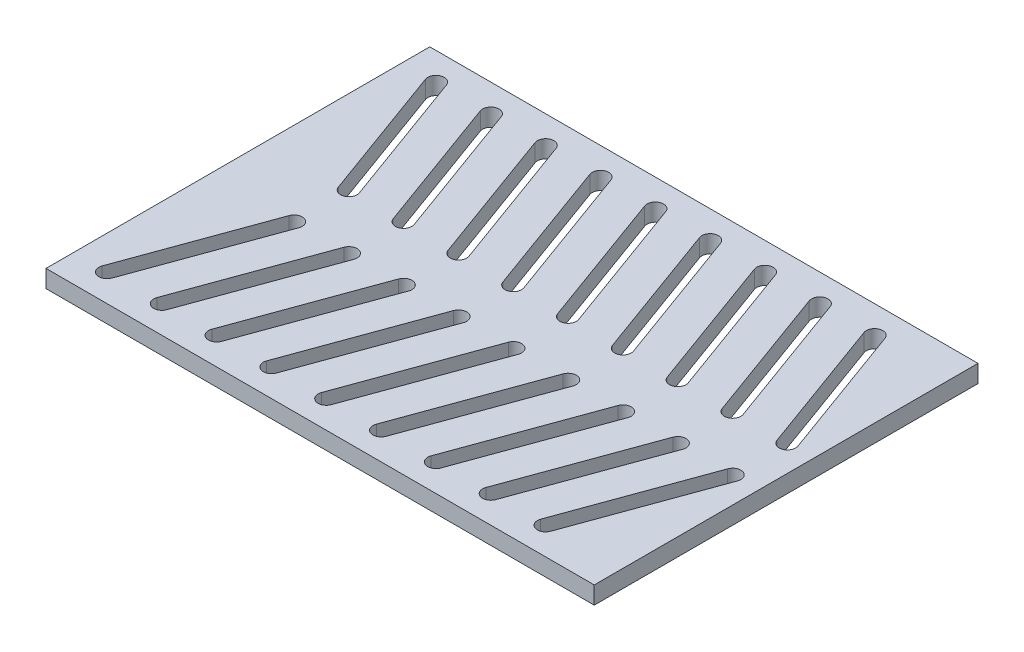
from build123d import *

# Parameters (mm, degrees)
SKETCH_1_W      = 100
SKETCH_1_H      = 70
EXTRUDE_1_DEPTH = 3.2


with BuildPart() as part:
    # Эскиз1 → Бобышка-Вытянуть1 (new body)
    with BuildSketch(Plane(origin=(0, 0, 0), x_dir=(1, 0, 0), z_dir=(0, 1, 0))):
        Rectangle(SKETCH_1_W, SKETCH_1_H)
        with BuildLine():
            Line((-42.453867058, 30.513030215), (-33.354611201, 5.513030215))
            ThreePointArc((-33.354611201, 5.513030215), (-34.251119917, 3.590461069), (-36.173689063, 4.486969785))
            Line((-36.173689063, 4.486969785), (-45.27294492, 29.486969785))
            ThreePointArc((-45.27294492, 29.486969785), (-44.376436204, 31.409538931), (-42.453867058, 30.513030215))
        make_face(mode=Mode.SUBTRACT)
        with BuildLine():
            Line((-32.453867058, 30.513030215), (-23.354611201, 5.513030215))
            ThreePointArc((-23.354611201, 5.513030215), (-24.251119917, 3.590461069), (-26.173689063, 4.486969785))
            Line((-26.173689063, 4.486969785), (-35.27294492, 29.486969785))
            ThreePointArc((-35.27294492, 29.486969785), (-34.376436204, 31.409538931), (-32.453867058, 30.513030215))
        make_face(mode=Mode.SUBTRACT)
        with BuildLine():
            Line((-22.453867058, 30.513030215), (-13.354611201, 5.513030215))
            ThreePointArc((-13.354611201, 5.513030215), (-14.251119917, 3.590461069), (-16.173689063, 4.486969785))
            Line((-16.173689063, 4.486969785), (-25.27294492, 29.486969785))
            ThreePointArc((-25.27294492, 29.486969785), (-24.376436204, 31.409538931), (-22.453867058, 30.513030215))
        make_face(mode=Mode.SUBTRACT)
        with BuildLine():
            Line((-12.453867058, 30.513030215), (-3.354611201, 5.513030215))
            ThreePointArc((-3.354611201, 5.513030215), (-4.251119917, 3.590461069), (-6.173689063, 4.486969785))
            Line((-6.173689063, 4.486969785), (-15.27294492, 29.486969785))
            ThreePointArc((-15.27294492, 29.486969785), (-14.376436204, 31.409538931), (-12.453867058, 30.513030215))
        make_face(mode=Mode.SUBTRACT)
        with BuildLine():
            Line((-2.453867058, 30.513030215), (6.645388799, 5.513030215))
            ThreePointArc((6.645388799, 5.513030215), (5.748880083, 3.590461069), (3.826310937, 4.486969785))
            Line((3.826310937, 4.486969785), (-5.27294492, 29.486969785))
            ThreePointArc((-5.27294492, 29.486969785), (-4.376436204, 31.409538931), (-2.453867058, 30.513030215))
        make_face(mode=Mode.SUBTRACT)
        with BuildLine():
            Line((7.546132942, 30.513030215), (16.645388799, 5.513030215))
            ThreePointArc((16.645388799, 5.513030215), (15.748880083, 3.590461069), (13.826310937, 4.486969785))
            Line((13.826310937, 4.486969785), (4.72705508, 29.486969785))
            ThreePointArc((4.72705508, 29.486969785), (5.623563796, 31.409538931), (7.546132942, 30.513030215))
        make_face(mode=Mode.SUBTRACT)
        with BuildLine():
            Line((17.546132942, 30.513030215), (26.645388799, 5.513030215))
            ThreePointArc((26.645388799, 5.513030215), (25.748880083, 3.590461069), (23.826310937, 4.486969785))
            Line((23.826310937, 4.486969785), (14.72705508, 29.486969785))
            ThreePointArc((14.72705508, 29.486969785), (15.623563796, 31.409538931), (17.546132942, 30.513030215))
        make_face(mode=Mode.SUBTRACT)
        with BuildLine():
            Line((27.546132942, 30.513030215), (36.645388799, 5.513030215))
            ThreePointArc((36.645388799, 5.513030215), (35.748880083, 3.590461069), (33.826310937, 4.486969785))
            Line((33.826310937, 4.486969785), (24.72705508, 29.486969785))
            ThreePointArc((24.72705508, 29.486969785), (25.623563796, 31.409538931), (27.546132942, 30.513030215))
        make_face(mode=Mode.SUBTRACT)
        with BuildLine():
            Line((37.546132942, 30.513030215), (46.645388799, 5.513030215))
            ThreePointArc((46.645388799, 5.513030215), (45.748880083, 3.590461069), (43.826310937, 4.486969785))
            Line((43.826310937, 4.486969785), (34.72705508, 29.486969785))
            ThreePointArc((34.72705508, 29.486969785), (35.623563796, 31.409538931), (37.546132942, 30.513030215))
        make_face(mode=Mode.SUBTRACT)
        with BuildLine():
            Line((-2.453867058, -30.513030215), (6.645388799, -5.513030215))
            ThreePointArc((6.645388799, -5.513030215), (5.748880083, -3.590461069), (3.826310937, -4.486969785))
            Line((3.826310937, -4.486969785), (-5.27294492, -29.486969785))
            ThreePointArc((-5.27294492, -29.486969785), (-4.376436204, -31.409538931), (-2.453867058, -30.513030215))
        make_face(mode=Mode.SUBTRACT)
        with BuildLine():
            Line((37.546132942, -30.513030215), (46.645388799, -5.513030215))
            ThreePointArc((46.645388799, -5.513030215), (45.748880083, -3.590461069), (43.826310937, -4.486969785))
            Line((43.826310937, -4.486969785), (34.72705508, -29.486969785))
            ThreePointArc((34.72705508, -29.486969785), (35.623563796, -31.409538931), (37.546132942, -30.513030215))
        make_face(mode=Mode.SUBTRACT)
        with BuildLine():
            Line((27.546132942, -30.513030215), (36.645388799, -5.513030215))
            ThreePointArc((36.645388799, -5.513030215), (35.748880083, -3.590461069), (33.826310937, -4.486969785))
            Line((33.826310937, -4.486969785), (24.72705508, -29.486969785))
            ThreePointArc((24.72705508, -29.486969785), (25.623563796, -31.409538931), (27.546132942, -30.513030215))
        make_face(mode=Mode.SUBTRACT)
        with BuildLine():
            Line((17.546132942, -30.513030215), (26.645388799, -5.513030215))
            ThreePointArc((26.645388799, -5.513030215), (25.748880083, -3.590461069), (23.826310937, -4.486969785))
            Line((23.826310937, -4.486969785), (14.72705508, -29.486969785))
            ThreePointArc((14.72705508, -29.486969785), (15.623563796, -31.409538931), (17.546132942, -30.513030215))
        make_face(mode=Mode.SUBTRACT)
        with BuildLine():
            Line((7.546132942, -30.513030215), (16.645388799, -5.513030215))
            ThreePointArc((16.645388799, -5.513030215), (15.748880083, -3.590461069), (13.826310937, -4.486969785))
            Line((13.826310937, -4.486969785), (4.72705508, -29.486969785))
            ThreePointArc((4.72705508, -29.486969785), (5.623563796, -31.409538931), (7.546132942, -30.513030215))
        make_face(mode=Mode.SUBTRACT)
        with BuildLine():
            Line((-12.453867058, -30.513030215), (-3.354611201, -5.513030215))
            ThreePointArc((-3.354611201, -5.513030215), (-4.251119917, -3.590461069), (-6.173689063, -4.486969785))
            Line((-6.173689063, -4.486969785), (-15.27294492, -29.486969785))
            ThreePointArc((-15.27294492, -29.486969785), (-14.376436204, -31.409538931), (-12.453867058, -30.513030215))
        make_face(mode=Mode.SUBTRACT)
        with BuildLine():
            Line((-22.453867058, -30.513030215), (-13.354611201, -5.513030215))
            ThreePointArc((-13.354611201, -5.513030215), (-14.251119917, -3.590461069), (-16.173689063, -4.486969785))
            Line((-16.173689063, -4.486969785), (-25.27294492, -29.486969785))
            ThreePointArc((-25.27294492, -29.486969785), (-24.376436204, -31.409538931), (-22.453867058, -30.513030215))
        make_face(mode=Mode.SUBTRACT)
        with BuildLine():
            Line((-32.453867058, -30.513030215), (-23.354611201, -5.513030215))
            ThreePointArc((-23.354611201, -5.513030215), (-24.251119917, -3.590461069), (-26.173689063, -4.486969785))
            Line((-26.173689063, -4.486969785), (-35.27294492, -29.486969785))
            ThreePointArc((-35.27294492, -29.486969785), (-34.376436204, -31.409538931), (-32.453867058, -30.513030215))
        make_face(mode=Mode.SUBTRACT)
        with BuildLine():
            Line((-42.453867058, -30.513030215), (-33.354611201, -5.513030215))
            ThreePointArc((-33.354611201, -5.513030215), (-34.251119917, -3.590461069), (-36.173689063, -4.486969785))
            Line((-36.173689063, -4.486969785), (-45.27294492, -29.486969785))
            ThreePointArc((-45.27294492, -29.486969785), (-44.376436204, -31.409538931), (-42.453867058, -30.513030215))
        make_face(mode=Mode.SUBTRACT)
    extrude(amount=EXTRUDE_1_DEPTH)


solid = part.part
